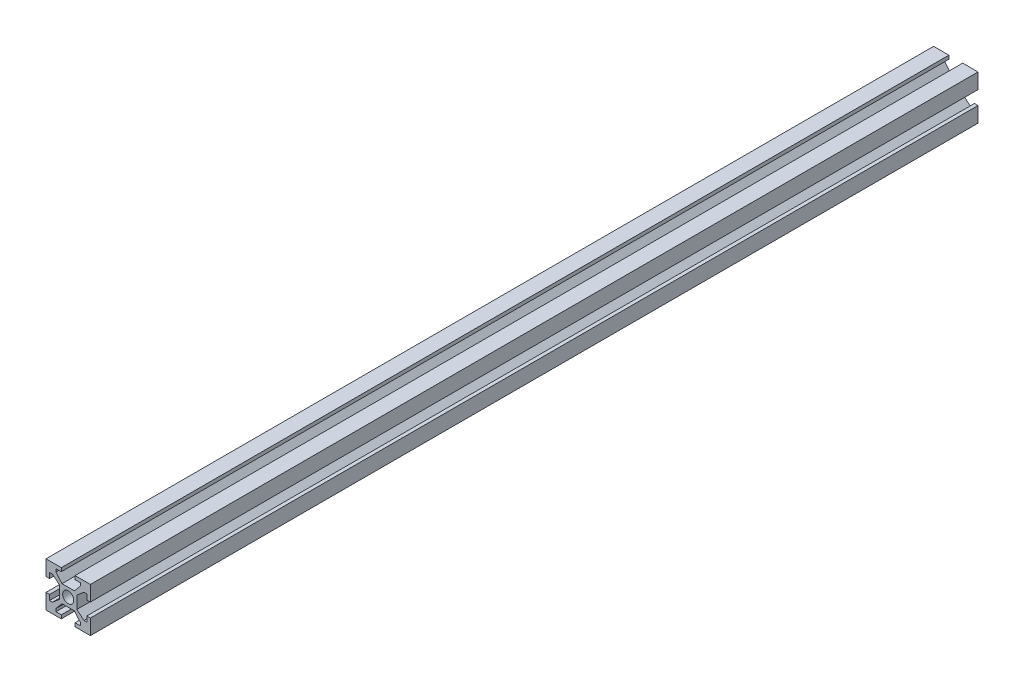
from build123d import *

# Parameters (mm, degrees)
SKETCH_1_R      = 2.5
EXTRUDE_1_DEPTH = 400


with BuildPart() as part:
    # 草图1 → 凸台-拉伸1 (new body)
    with BuildSketch(Plane.XY):
        Polygon((-20, 20), (-13.1, 20), (-13.1, 18.4), (-15.5, 18.4), (-15.5, 17.104298633), (-12.797022805, 13.9), (-7.202977195, 13.9), (-4.5, 17.104298633), (-4.5, 18.4), (-6.9, 18.4), (-6.9, 20), (0, 20), (0, 13.1), (-1.6, 13.1), (-1.6, 15.5), (-2.895701367, 15.5), (-6.1, 12.797022805), (-6.1, 7.202977195), (-2.895701367, 4.5), (-1.6, 4.5), (-1.6, 6.9), (0, 6.9), (0, 0), (-6.9, 0), (-6.9, 1.6), (-4.5, 1.6), (-4.5, 2.895701367), (-7.202977195, 6.1), (-12.797022805, 6.1), (-15.5, 2.895701367), (-15.5, 1.6), (-13.1, 1.6), (-13.1, 0), (-20, 0), (-20, 6.9), (-18.4, 6.9), (-18.4, 4.5), (-17.104298633, 4.5), (-13.9, 7.202977195), (-13.9, 12.797022805), (-17.104298633, 15.5), (-18.4, 15.5), (-18.4, 13.1), (-20, 13.1), align=None)
        with Locations((-10, 10)):
            Circle(SKETCH_1_R, mode=Mode.SUBTRACT)
    extrude(amount=EXTRUDE_1_DEPTH)


solid = part.part
